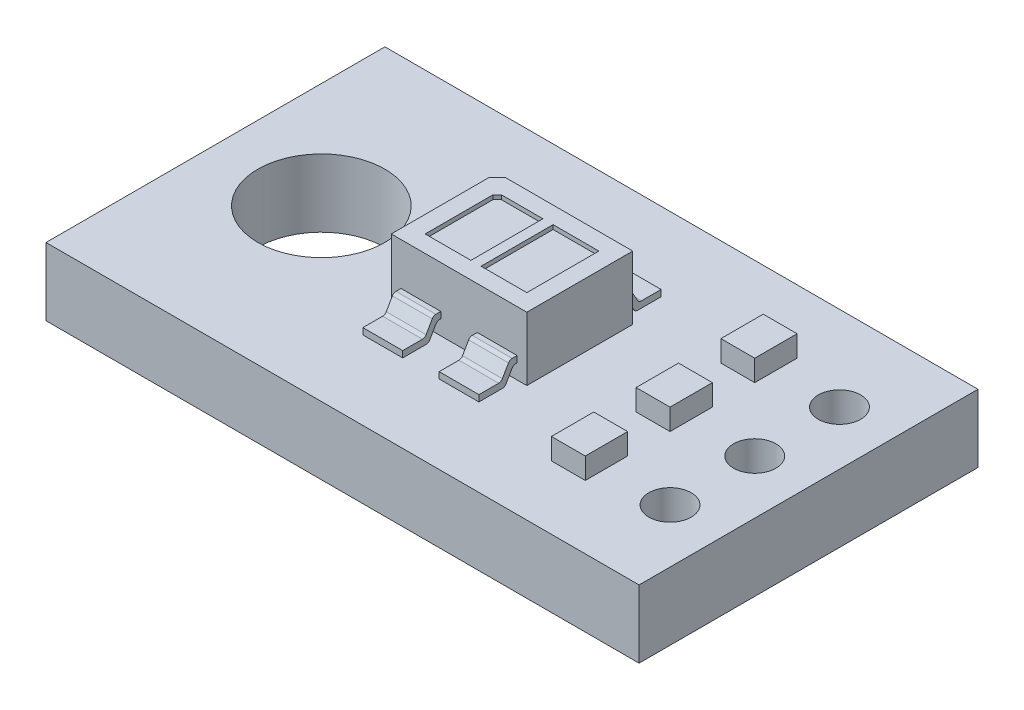
from build123d import *

# Parameters (mm, degrees)
SKETCH1_W             = 14
SKETCH1_H             = 8
SKETCH1_R             = 1.5
SKETCH1_R_2           = 0.5
BOSS_EXTRUDE1_DEPTH   = 1.6
SKETCH2_W             = 0.8
SKETCH2_H             = 1
BOSS_EXTRUDE2_DEPTH   = 0.5
BOSS_EXTRUDE2_2_DEPTH = 0.5
BOSS_EXTRUDE2_3_DEPTH = 0.5
BOSS_EXTRUDE3_DEPTH   = 1.5
SKETCH4_W             = 1.08
SKETCH4_H             = 1.7
CUT_EXTRUDE1_DEPTH    = 0.1
BOSS_EXTRUDE4_DEPTH   = 3.2
BOSS_EXTRUDE4_2_DEPTH = 3.2
CUT_EXTRUDE2_START    = -3.1
SKETCH6_W             = 0.23
SKETCH6_H             = 0.9
SKETCH6_W_2           = 0.86
CUT_EXTRUDE2_DEPTH    = 3.1


with BuildPart() as part:
    # Sketch1 → Boss-Extrude1 (new body)
    with BuildSketch(Plane(origin=(0, 0, 0), x_dir=(1, 0, 0), z_dir=(0, 1, 0))):
        Rectangle(SKETCH1_W, SKETCH1_H)
        with Locations(Location((-4.5, 0, 0), (0, 0, 270))):
            Circle(SKETCH1_R, mode=Mode.SUBTRACT)
        with Locations(Location((5.73, 2, 0), (0, 0, 270))):
            Circle(SKETCH1_R_2, mode=Mode.SUBTRACT)
        with Locations(Location((5.73, -2, 0), (0, 0, 270))):
            Circle(SKETCH1_R_2, mode=Mode.SUBTRACT)
        with Locations(Location((5.73, 0, 0), (0, 0, 270))):
            Circle(SKETCH1_R_2, mode=Mode.SUBTRACT)
    extrude(amount=BOSS_EXTRUDE1_DEPTH)


with BuildPart() as body_2:
    # Sketch2 → Boss-Extrude2 (new body)
    with BuildSketch(Plane(origin=(0, 1.6, 0), x_dir=(1, 0, 0), z_dir=(0, 1, 0))):
        with Locations((3.83, 2)):
            Rectangle(SKETCH2_W, SKETCH2_H)
    extrude(amount=BOSS_EXTRUDE2_DEPTH)


with BuildPart() as body_3:
    # Sketch2 → Boss-Extrude2 2 (new body)
    with BuildSketch(Plane(origin=(0, 1.6, 0), x_dir=(1, 0, 0), z_dir=(0, 1, 0))):
        with Locations((3.83, 0)):
            Rectangle(SKETCH2_W, SKETCH2_H)
    extrude(amount=BOSS_EXTRUDE2_2_DEPTH)


with BuildPart() as body_4:
    # Sketch2 → Boss-Extrude2 3 (new body)
    with BuildSketch(Plane(origin=(0, 1.6, 0), x_dir=(1, 0, 0), z_dir=(0, 1, 0))):
        with Locations((3.83, -2)):
            Rectangle(SKETCH2_W, SKETCH2_H)
    extrude(amount=BOSS_EXTRUDE2_3_DEPTH)


with BuildPart() as body_5:
    # Sketch3 → Boss-Extrude3 (new body)
    with BuildSketch(Plane(origin=(0, 1.6, 0), x_dir=(1, 0, 0), z_dir=(0, 1, 0))):
        Polygon((1.6, 1.25), (-1.4, 1.25), (-1.6, 1.05), (-1.6, -1.25), (1.6, -1.25), align=None)
    extrude(amount=BOSS_EXTRUDE3_DEPTH)

    # Sketch4 → Cut-Extrude1 (cut)
    with BuildSketch(Plane(origin=(0, 3.1, 0), x_dir=(1, 0, 0), z_dir=(0, 1, 0))):
        with Locations((0.66, 0)):
            Rectangle(SKETCH4_W, SKETCH4_H)
        Polygon((-0.12, 0.85), (-1.1, 0.85), (-1.2, 0.75), (-1.2, -0.85), (-0.12, -0.85), align=None)
    extrude(amount=-CUT_EXTRUDE1_DEPTH, mode=Mode.SUBTRACT)


with BuildPart() as body_6:
    # Sketch5 → Boss-Extrude4 (new body)
    with BuildSketch(Plane.ZY.offset(1.6)):
        with BuildLine():
            Line((1.25, 2.1), (1.366794919, 2.1))
            ThreePointArc((1.366794919, 2.1), (1.416794919, 2.08660254), (1.45339746, 2.05))
            Line((1.45339746, 2.05), (1.597735027, 1.8))
            ThreePointArc((1.597735027, 1.8), (1.634337567, 1.76339746), (1.684337567, 1.75))
            Line((1.684337567, 1.75), (2.15, 1.75))
            Line((2.15, 1.75), (2.15, 1.6))
            Line((2.15, 1.6), (1.597735027, 1.6))
            ThreePointArc((1.597735027, 1.6), (1.547735027, 1.61339746), (1.511132487, 1.65))
            Line((1.511132487, 1.65), (1.366794919, 1.9))
            ThreePointArc((1.366794919, 1.9), (1.330192379, 1.93660254), (1.280192379, 1.95))
            Line((1.280192379, 1.95), (1.25, 1.95))
            Line((1.25, 1.95), (1.25, 2.1))
        make_face()
    extrude(amount=-BOSS_EXTRUDE4_DEPTH)


with BuildPart() as body_7:
    # Sketch5 → Boss-Extrude4 2 (new body)
    with BuildSketch(Plane.ZY.offset(1.6)):
        with BuildLine():
            Line((-1.25, 2.1), (-1.25, 1.95))
            Line((-1.25, 1.95), (-1.280192379, 1.95))
            ThreePointArc((-1.280192379, 1.95), (-1.330192379, 1.93660254), (-1.366794919, 1.9))
            Line((-1.366794919, 1.9), (-1.511132487, 1.65))
            ThreePointArc((-1.511132487, 1.65), (-1.547735027, 1.61339746), (-1.597735027, 1.6))
            Line((-1.597735027, 1.6), (-2.15, 1.6))
            Line((-2.15, 1.6), (-2.15, 1.75))
            Line((-2.15, 1.75), (-1.684337567, 1.75))
            ThreePointArc((-1.684337567, 1.75), (-1.634337567, 1.76339746), (-1.597735027, 1.8))
            Line((-1.597735027, 1.8), (-1.45339746, 2.05))
            ThreePointArc((-1.45339746, 2.05), (-1.416794919, 2.08660254), (-1.366794919, 2.1))
            Line((-1.366794919, 2.1), (-1.25, 2.1))
        make_face()
    extrude(amount=-BOSS_EXTRUDE4_2_DEPTH)


with BuildPart() as cut_extrude2_tool:
    # Sketch6 → Cut-Extrude2 (new body)
    with BuildSketch(Plane(origin=(0, 3.1, 0), x_dir=(1, 0, 0), z_dir=(0, 1, 0)).offset(CUT_EXTRUDE2_START)):
        with Locations((1.485, 1.7)):
            Rectangle(SKETCH6_W, SKETCH6_H)
        with Locations((0, 1.7)):
            Rectangle(SKETCH6_W_2, SKETCH6_H)
        with Locations((-1.485, 1.7)):
            Rectangle(SKETCH6_W, SKETCH6_H)
        with Locations((-1.485, -1.7)):
            Rectangle(SKETCH6_W, SKETCH6_H)
        with Locations((0, -1.7)):
            Rectangle(SKETCH6_W_2, SKETCH6_H)
        with Locations((1.485, -1.7)):
            Rectangle(SKETCH6_W, SKETCH6_H)
    extrude(amount=CUT_EXTRUDE2_DEPTH)


with BuildPart() as body_7_1:
    add(body_7.part)

    # Cut-Extrude2: cut by cut_extrude2_tool
    add(cut_extrude2_tool.part, mode=Mode.SUBTRACT)


with BuildPart() as body_6_1:
    add(body_6.part)

    # Cut-Extrude2: cut by cut_extrude2_tool
    add(cut_extrude2_tool.part, mode=Mode.SUBTRACT)


with BuildPart() as cut_extrude2_piece_1:
    # of the separate pieces the step leaves, piece 1, a body of its own (cut_extrude2_pieces)
    add(body_6_1.part.solids().sort_by_distance((-1.37, 2.1, 1.25))[0])


with BuildPart() as cut_extrude2_piece_2:
    # of the separate pieces the step leaves, piece 2, a body of its own (cut_extrude2_pieces)
    add(body_6_1.part.solids().sort_by_distance((0.43, 2.1, 1.25))[0])


with BuildPart() as cut_extrude2_piece_1_of_body_7:
    # of the separate pieces the step leaves, piece 1, a body of its own (cut_extrude2_pieces_of_body_7)
    add(body_7_1.part.solids().sort_by_distance((-1.37, 1.95, -1.25))[0])


with BuildPart() as cut_extrude2_piece_2_of_body_7:
    # of the separate pieces the step leaves, piece 2, a body of its own (cut_extrude2_pieces_of_body_7)
    add(body_7_1.part.solids().sort_by_distance((0.43, 1.95, -1.25))[0])


solid = Compound([part.part, body_2.part, body_3.part, body_4.part, body_5.part, cut_extrude2_piece_1.part, cut_extrude2_piece_2.part, cut_extrude2_piece_1_of_body_7.part, cut_extrude2_piece_2_of_body_7.part])
